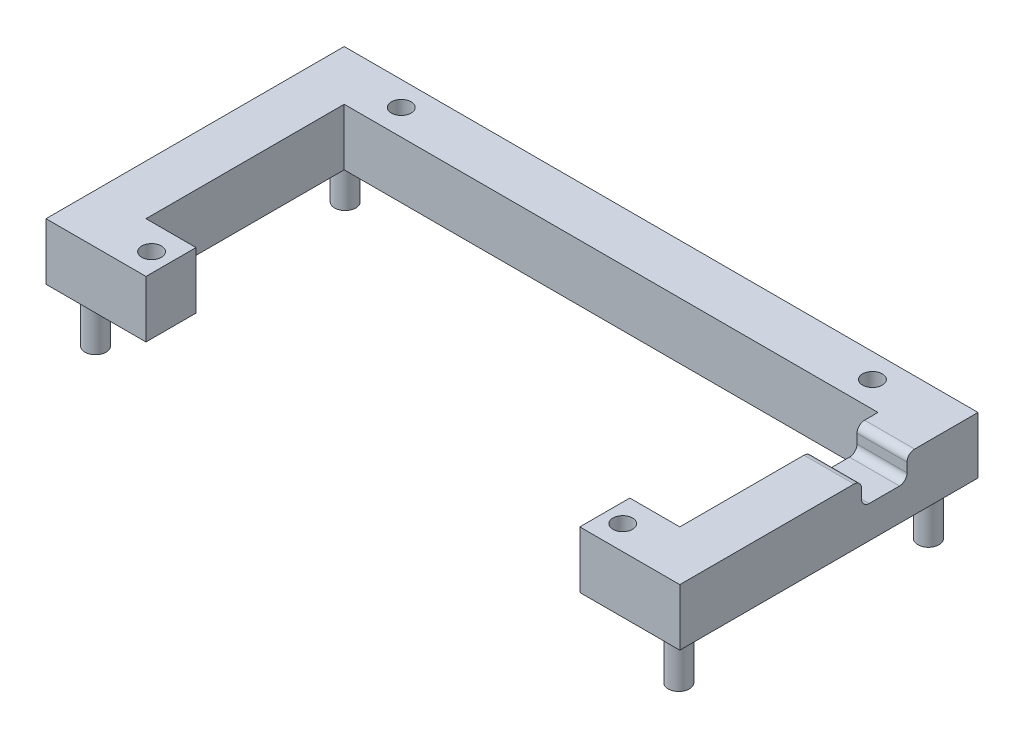
from build123d import *

# Parameters (mm, degrees)
SKETCH1_R           = 1.651
BOSS_EXTRUDE1_DEPTH = 9.525
SKETCH2_W           = 7.62
SKETCH2_H           = 4.099575227
CUT_EXTRUDE7_DEPTH  = 8.89
FILLET2_R           = 1.27
SKETCH3_R           = 1.778
BOSS_EXTRUDE3_DEPTH = 8.89


with BuildPart() as part:
    # Sketch1 → Boss-Extrude1 (new body)
    with BuildSketch(Plane(origin=(0, 0, 0), x_dir=(1, 0, 0), z_dir=(0, 1, 0))):
        Polygon((75.155177047, 61.997896552), (75.155177047, 11.997896552), (91.919177047, 11.997896552), (91.919177047, 20.379896552), (83.537177047, 20.379896552), (83.537177047, 53.615896552), (173.037829354, 53.615896552), (173.037829354, 20.379896552), (164.655829354, 20.379896552), (164.655829354, 11.997896552), (181.419829354, 11.997896552), (181.419829354, 61.997896552), align=None)
        with Locations(Location((88.7874552, 16.064784874, 0), (0, 0, 90))):
            Circle(SKETCH1_R, mode=Mode.SUBTRACT)
        with Locations(Location((167.7875512, 57.93100823, 0), (0, 0, 90))):
            Circle(SKETCH1_R, mode=Mode.SUBTRACT)
        with Locations(Location((88.7874552, 57.93100823, 0), (0, 0, 90))):
            Circle(SKETCH1_R, mode=Mode.SUBTRACT)
        with Locations(Location((167.7875512, 16.064784874, 0), (0, 0, 90))):
            Circle(SKETCH1_R, mode=Mode.SUBTRACT)
    extrude(amount=BOSS_EXTRUDE1_DEPTH)

    # Sketch2 → Cut-Extrude7 (cut)
    with BuildSketch(Plane(origin=(181.419829354, 0, 0), x_dir=(0, 0, -1), z_dir=(1, 0, 0))):
        with Locations((46.287896552, 7.475212387)):
            Rectangle(SKETCH2_W, SKETCH2_H)
    extrude(amount=-CUT_EXTRUDE7_DEPTH, mode=Mode.SUBTRACT)

    # Fillet2
    fillet2_edges = [part.edges().sort_by_distance(p)[0] for p in [
        (177.228829354, 9.525, -42.477896552),
        (177.228829354, 9.525, -50.097896552),
        (177.228829354, 5.425424773, -50.097896552),
        (177.228829354, 5.425424773, -42.477896552),
    ]]
    fillet(fillet2_edges, radius=FILLET2_R)

    # Sketch3 → Boss-Extrude3 (add)
    with BuildSketch(Plane.XZ):
        with Locations(Location((79.3894552, -16.064784874, 0), (0, 0, 90))):
            Circle(SKETCH3_R)
        with Locations(Location((177.1855512, -16.064784874, 0), (0, 0, 90))):
            Circle(SKETCH3_R)
        with Locations(Location((79.3894552, -57.93100823, 0), (0, 0, 90))):
            Circle(SKETCH3_R)
        with Locations(Location((177.1855512, -57.93100823, 0), (0, 0, 90))):
            Circle(SKETCH3_R)
    extrude(amount=BOSS_EXTRUDE3_DEPTH)


solid = part.part
